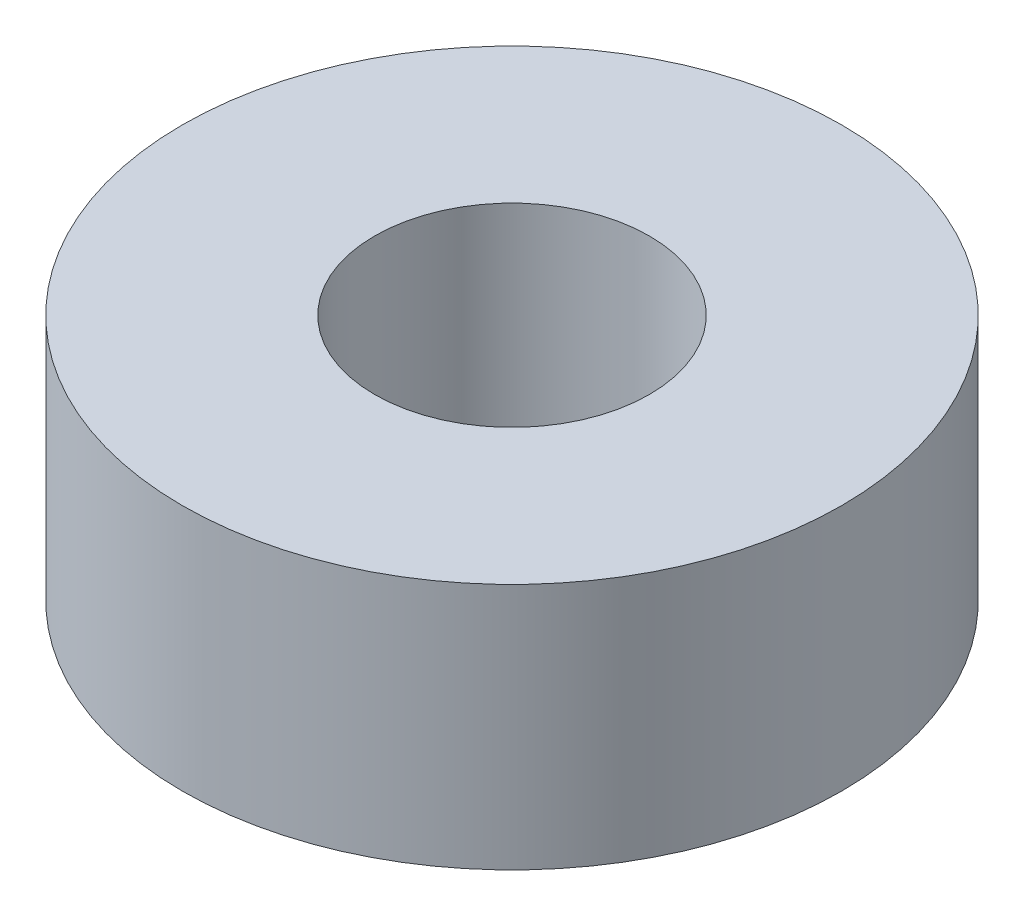
from build123d import *

# Parameters (mm, degrees)
BOSS_EXTRUDE1_DEPTH      = 4.5
BOSS_EXTRUDE1_DEPTH_BACK = 4.5
SKETCH1_R                = 12
SKETCH1_R_2              = 5


with BuildPart() as part:
    # Sketch1 → Boss-Extrude1 (new, two sides: drawn at the far end of the back side and taken through both)
    with BuildSketch(Plane(origin=(0, 0, 0), x_dir=(1, 0, 0), z_dir=(0, 1, 0)).offset(-BOSS_EXTRUDE1_DEPTH_BACK)):
        Circle(SKETCH1_R)
        Circle(SKETCH1_R_2, mode=Mode.SUBTRACT)
    extrude(amount=BOSS_EXTRUDE1_DEPTH + BOSS_EXTRUDE1_DEPTH_BACK)


solid = part.part
